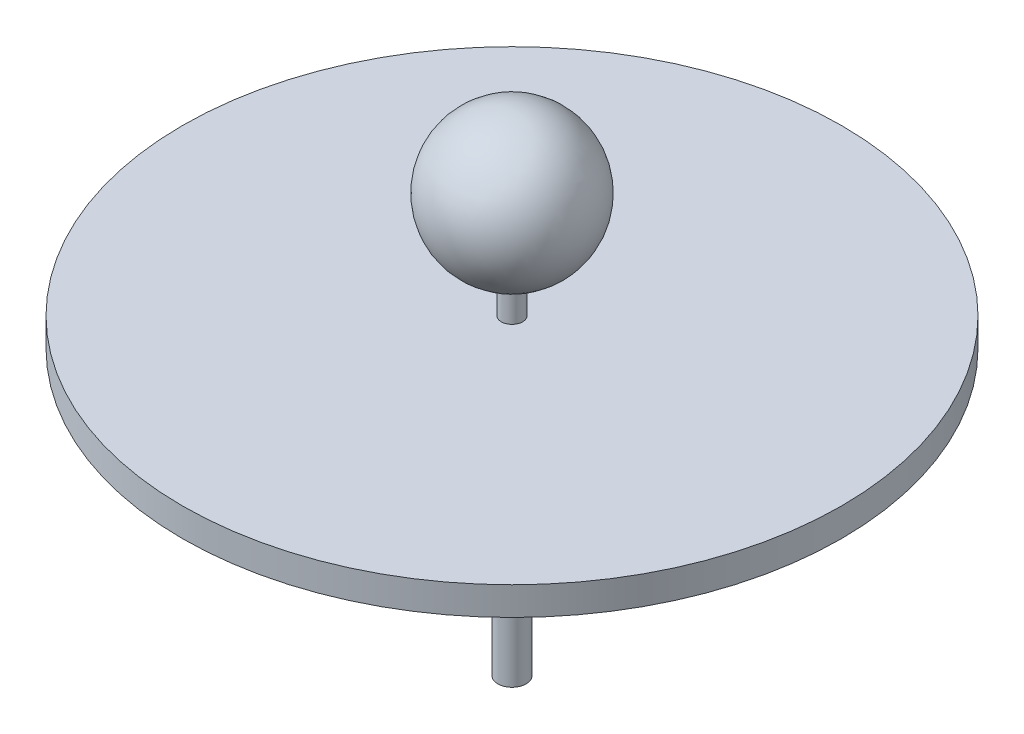
from build123d import *

# Parameters (mm, degrees)
SKETCH_2_R      = 20
EXTRUDE_1_DEPTH = 200


with BuildPart() as part:
    # 草图1 → 旋转1 (revolve)
    with BuildSketch(Plane.XY, mode=Mode.PRIVATE) as revolve_1_sk:
        with BuildLine():
            Line((0, 288.881257919), (0, 0))
            Line((0, 0), (20, 0))
            Line((20, 0), (20, 100))
            Line((20, 100), (15, 100))
            Line((15, 100), (15, 200))
            Line((15, 200), (465, 200))
            Line((465, 200), (465, 240))
            Line((465, 240), (15, 240))
            Line((15, 240), (15, 290))
            ThreePointArc((15, 290), (7.520830803, 289.161331306), (0, 288.881257919))
        make_face()
        with BuildLine():
            Line((0, 390), (0, 290))
            Line((0, 290), (15, 290))
            ThreePointArc((15, 290), (76.6217369, 324.014324021), (101.118742081, 390))
            ThreePointArc((101.118742081, 390), (71.50174823, 461.50174823), (0, 491.118742081))
            Line((0, 491.118742081), (0, 390))
        make_face()
        with BuildLine():
            Line((0, 290), (0, 288.881257919))
            ThreePointArc((0, 288.881257919), (7.520830803, 289.161331306), (15, 290))
            Line((15, 290), (0, 290))
        make_face()
    revolve(revolve_1_sk.sketch.rotate(Axis((0, 290, 0), (0, 1, 0)), 90), axis=Axis((0, 290, 0), (0, 1, 0)))

    # 草图2 → 凸台-拉伸1 (add)
    with BuildSketch(Plane.XZ):
        with Locations(Location((0, 0, 0), (0, 0, 270))):
            Circle(SKETCH_2_R)
    extrude(amount=EXTRUDE_1_DEPTH)


solid = part.part
